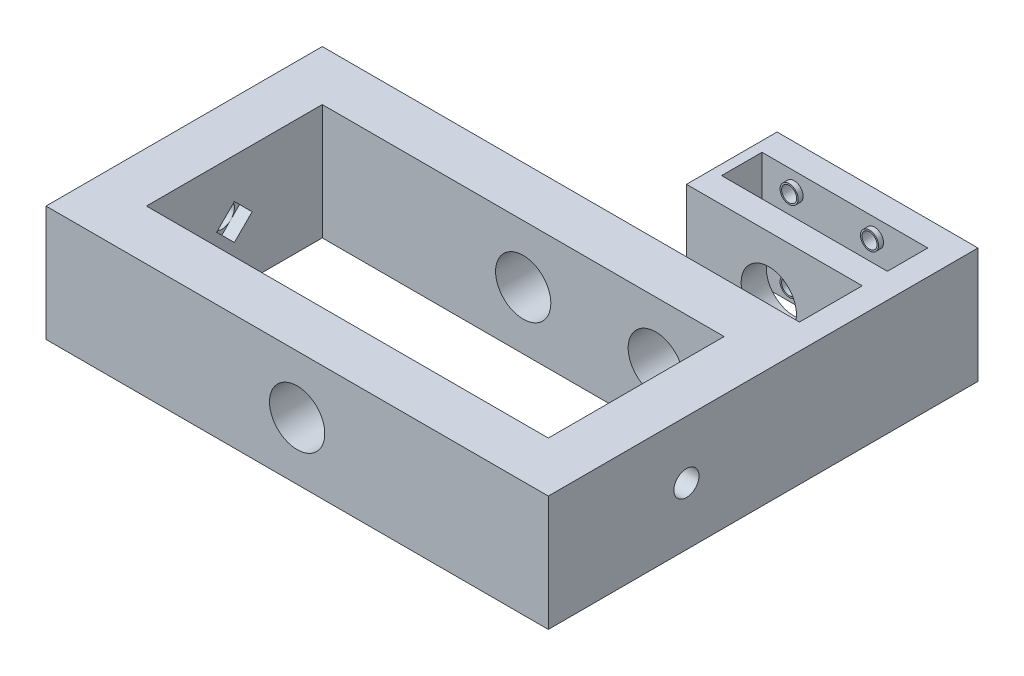
from build123d import *

# Parameters (mm, degrees)
SKETCH1_W           = 100
SKETCH1_H           = 55
SKETCH1_W_2         = 80
SKETCH1_H_2         = 35
BOSS_EXTRUDE1_DEPTH = 11.5
CUT_EXTRUDE1_REACH  = 106.348
SKETCH2_R           = 2.5
CUT_EXTRUDE2_REACH  = 77.215
SKETCH3_R           = 5.5
CUT_EXTRUDE3_START  = -2.5
CUT_EXTRUDE3_DEPTH  = 85
SKETCH5_R           = 5.5
CUT_EXTRUDE4_DEPTH  = 10
SKETCH6_W           = 33
SKETCH6_H           = 8.04
BOSS_EXTRUDE2_DEPTH = 11.5
SKETCH8_R           = 1.8
BOSS_EXTRUDE3_DEPTH = 1
CUT_EXTRUDE5_REACH  = 96.651
SKETCH9_R           = 1.5
CUT_EXTRUDE6_DEPTH  = 2.5
CUT_EXTRUDE7_START  = -5
SKETCH11_R          = 5.5
CUT_EXTRUDE7_DEPTH  = 5


with BuildPart() as part:
    # Sketch1 → Boss-Extrude1 (new, symmetric)
    with BuildSketch(Plane(origin=(0, 0, 0), x_dir=(1, 0, 0), z_dir=(0, 1, 0))):
        Rectangle(SKETCH1_W, SKETCH1_H)
        Rectangle(SKETCH1_W_2, SKETCH1_H_2, mode=Mode.SUBTRACT)
    extrude(amount=BOSS_EXTRUDE1_DEPTH, both=True)

    # Cut-Extrude1: up to this face of the body (flat: up to its plane)
    cut_extrude1_end = Plane(part.part.faces().sort_by_distance((-50, 0, 0))[0])
    # Sketch2 → Cut-Extrude1 (cut, up to the picked face)
    with BuildSketch(Plane(origin=(50, 0, 0), x_dir=(0, 0, -1), z_dir=(1, 0, 0)), mode=Mode.PRIVATE) as cut_extrude1_sk1:
        Circle(SKETCH2_R)
    cut_extrude1_tool1 = split(extrude(cut_extrude1_sk1.sketch, amount=-CUT_EXTRUDE1_REACH, mode=Mode.PRIVATE), bisect_by=cut_extrude1_end, keep=Keep.BOTH, mode=Mode.PRIVATE)
    add(cut_extrude1_tool1.solids().sort_by(Axis((50, 0, 0), (-1, 0, 0)))[0], mode=Mode.SUBTRACT)

    # Cut-Extrude2: up to this face of the body (flat: up to its plane)
    cut_extrude2_end = Plane(part.part.faces().sort_by_distance((0, 0, 27.5))[0])
    # Sketch3 → Cut-Extrude2 (cut, up to the picked face)
    with BuildSketch(Plane(origin=(0, 0, -27.5), x_dir=(-1, 0, 0), z_dir=(0, 0, -1)), mode=Mode.PRIVATE) as cut_extrude2_sk1:
        Circle(SKETCH3_R)
    cut_extrude2_tool1 = split(extrude(cut_extrude2_sk1.sketch, amount=-CUT_EXTRUDE2_REACH, mode=Mode.PRIVATE), bisect_by=cut_extrude2_end, keep=Keep.BOTH, mode=Mode.PRIVATE)
    add(cut_extrude2_tool1.solids().sort_by(Axis((0, 0, -27.5), (0, 0, 1)))[0], mode=Mode.SUBTRACT)

    # Sketch4 → Cut-Extrude3 (cut)
    with BuildSketch(Plane.ZY.offset(-40).offset(CUT_EXTRUDE3_START)):
        with BuildLine():
            ThreePointArc((1.767766953, -1.767766953), (2e-09, -2.5), (-1.767766951, -1.767766955))
            Line((-1.767766951, -1.767766955), (0, -3.535533906))
            Line((0, -3.535533906), (1.767766953, -1.767766953))
        make_face()
        with BuildLine():
            ThreePointArc((-1.767766951, -1.767766955), (-2.5, -2e-09), (-1.767766953, 1.767766953))
            Line((-1.767766953, 1.767766953), (-3.535533906, 0))
            Line((-3.535533906, 0), (-1.767766951, -1.767766955))
        make_face()
        with BuildLine():
            Line((1.767766953, 1.767766953), (0, 3.535533906))
            Line((0, 3.535533906), (-1.767766953, 1.767766953))
            ThreePointArc((-1.767766953, 1.767766953), (0, 2.5), (1.767766953, 1.767766953))
        make_face()
        with BuildLine():
            Line((3.535533906, 0), (1.767766953, 1.767766953))
            ThreePointArc((1.767766953, 1.767766953), (2.309698831, 0.956708581), (2.5, 0))
            ThreePointArc((2.5, 0), (2.309698831, -0.956708581), (1.767766953, -1.767766953))
            Line((1.767766953, -1.767766953), (3.535533906, 0))
        make_face()
    extrude(amount=CUT_EXTRUDE3_DEPTH, mode=Mode.SUBTRACT)

    # Sketch5 → Cut-Extrude4 (cut)
    with BuildSketch(Plane.XY.offset(-27.5)):
        with Locations((26.394, 0)):
            Circle(SKETCH5_R)
    extrude(amount=CUT_EXTRUDE4_DEPTH, mode=Mode.SUBTRACT)

    # Sketch6 → Boss-Extrude2 (add, symmetric)
    with BuildSketch(Plane(origin=(0, 0, 0), x_dir=(1, 0, 0), z_dir=(0, 1, 0))):
        Polygon((10, 58.04), (10, 40), (45, 40), (45, 27.5), (50, 27.5), (50, 58.04), align=None)
        with Locations((28.5, 49.02)):
            Rectangle(SKETCH6_W, SKETCH6_H, mode=Mode.SUBTRACT)
    extrude(amount=BOSS_EXTRUDE2_DEPTH, both=True)

    # Sketch8 → Boss-Extrude3 (add)
    with BuildSketch(Plane.XY.offset(-53.04)):
        with Locations(Location((18.394, 8, 0), (0, 0, 180))):
            Circle(SKETCH8_R)
        with Locations(Location((34.394, 8, 0), (0, 0, 180))):
            Circle(SKETCH8_R)
        with Locations(Location((34.394, -8, 0), (0, 0, 180))):
            Circle(SKETCH8_R)
        with Locations(Location((18.394, -8, 0), (0, 0, 180))):
            Circle(SKETCH8_R)
    extrude(amount=BOSS_EXTRUDE3_DEPTH)

    # Sketch9 → Cut-Extrude5 (cut, up to next)
    with BuildSketch(Plane.XY.offset(-52.04), mode=Mode.PRIVATE) as cut_extrude5_sk1:
        with Locations((18.394, 8)):
            Circle(SKETCH9_R)
    cut_extrude5_tool1 = extrude(cut_extrude5_sk1.sketch, amount=-CUT_EXTRUDE5_REACH, mode=Mode.PRIVATE) & part.part
    # Sketch9 → Cut-Extrude5 (cut, up to next)
    with BuildSketch(Plane.XY.offset(-52.04), mode=Mode.PRIVATE) as cut_extrude5_sk2:
        with Locations((34.394, 8)):
            Circle(SKETCH9_R)
    cut_extrude5_tool2 = extrude(cut_extrude5_sk2.sketch, amount=-CUT_EXTRUDE5_REACH, mode=Mode.PRIVATE) & part.part
    # Sketch9 → Cut-Extrude5 (cut, up to next)
    with BuildSketch(Plane.XY.offset(-52.04), mode=Mode.PRIVATE) as cut_extrude5_sk3:
        with Locations((34.394, -8)):
            Circle(SKETCH9_R)
    cut_extrude5_tool3 = extrude(cut_extrude5_sk3.sketch, amount=-CUT_EXTRUDE5_REACH, mode=Mode.PRIVATE) & part.part
    # Sketch9 → Cut-Extrude5 (cut, up to next)
    with BuildSketch(Plane.XY.offset(-52.04), mode=Mode.PRIVATE) as cut_extrude5_sk4:
        with Locations((18.394, -8)):
            Circle(SKETCH9_R)
    cut_extrude5_tool4 = extrude(cut_extrude5_sk4.sketch, amount=-CUT_EXTRUDE5_REACH, mode=Mode.PRIVATE) & part.part
    add(cut_extrude5_tool1.solids().sort_by_distance((18.394, 8, -52.04))[0], mode=Mode.SUBTRACT)
    add(cut_extrude5_tool2.solids().sort_by_distance((34.394, 8, -52.04))[0], mode=Mode.SUBTRACT)
    add(cut_extrude5_tool3.solids().sort_by_distance((34.394, -8, -52.04))[0], mode=Mode.SUBTRACT)
    add(cut_extrude5_tool4.solids().sort_by_distance((18.394, -8, -52.04))[0], mode=Mode.SUBTRACT)

    # Sketch10 → Cut-Extrude6 (cut)
    with BuildSketch(Plane(origin=(0, 0, -58.04), x_dir=(-1, 0, 0), z_dir=(0, 0, -1))):
        Polygon((-31.644, 6.41228676), (-31.644, 9.58771324), (-34.394, 11.175426481), (-37.144, 9.58771324), (-37.144, 6.41228676), (-34.394, 4.824573519), align=None)
        Polygon((-15.644, 6.41228676), (-15.644, 9.58771324), (-18.394, 11.175426481), (-21.144, 9.58771324), (-21.144, 6.41228676), (-18.394, 4.824573519), align=None)
        Polygon((-15.644, -9.58771324), (-15.644, -6.41228676), (-18.394, -4.824573519), (-21.144, -6.41228676), (-21.144, -9.58771324), (-18.394, -11.175426481), align=None)
        Polygon((-31.644, -9.58771324), (-31.644, -6.41228676), (-34.394, -4.824573519), (-37.144, -6.41228676), (-37.144, -9.58771324), (-34.394, -11.175426481), align=None)
    extrude(amount=-CUT_EXTRUDE6_DEPTH, mode=Mode.SUBTRACT)

    # Sketch11 → Cut-Extrude7 (cut)
    with BuildSketch(Plane.XY.offset(-40).offset(CUT_EXTRUDE7_START)):
        with Locations((26.394, 0)):
            Circle(SKETCH11_R)
    extrude(amount=CUT_EXTRUDE7_DEPTH, mode=Mode.SUBTRACT)


solid = part.part
